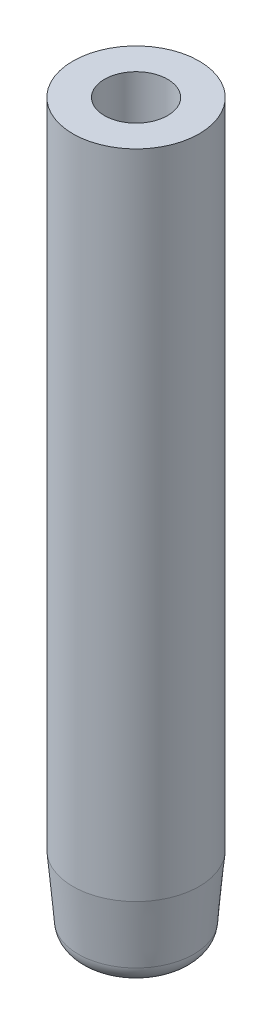
from build123d import *

# Parameters (mm, degrees)
SKETCH1_R           = 6.35
BOSS_EXTRUDE1_DEPTH = 65.6
SKETCH2_R           = 3.175
INNER_CHAMBER_DEPTH = 60
SKETCH4_R           = 6.35
HEAD_DEPTH          = 8
HEAD_TAPER          = 5
FILLET1_R           = 2
SKETCH5_R           = 0.5
CUT_EXTRUDE2_DEPTH  = 8


with BuildPart() as part:
    # Sketch1 → Boss-Extrude1 (new body)
    with BuildSketch(Plane(origin=(0, 0, 0), x_dir=(1, 0, 0), z_dir=(0, 1, 0))):
        with Locations(Location((0, 0, 0), (0, 0, 270))):
            Circle(SKETCH1_R)
    extrude(amount=BOSS_EXTRUDE1_DEPTH)

    # Sketch2 → Inner Chamber (cut)
    with BuildSketch(Plane(origin=(0, 65.6, 0), x_dir=(1, 0, 0), z_dir=(0, 1, 0))):
        with Locations(Location((0, 0, 0), (0, 0, 270))):
            Circle(SKETCH2_R)
    extrude(amount=-INNER_CHAMBER_DEPTH, mode=Mode.SUBTRACT)

    # Sketch4 → Head (add)
    with BuildSketch(Plane.XZ):
        with Locations(Location((0, 0, 0), (0, 0, 270))):
            Circle(SKETCH4_R)
    extrude(amount=HEAD_DEPTH, taper=HEAD_TAPER)

    # Fillet1
    fillet1_edges = [part.edges().sort_by_distance(p)[0] for p in [
        (0, -8, 5.650090692),
    ]]
    fillet(fillet1_edges, radius=FILLET1_R)

    # Sketch5 → Cut-Extrude2 (cut)
    with BuildSketch(Plane.XY):
        with Locations((0, -5)):
            Circle(SKETCH5_R)
    extrude(amount=-CUT_EXTRUDE2_DEPTH, mode=Mode.SUBTRACT)


solid = part.part
